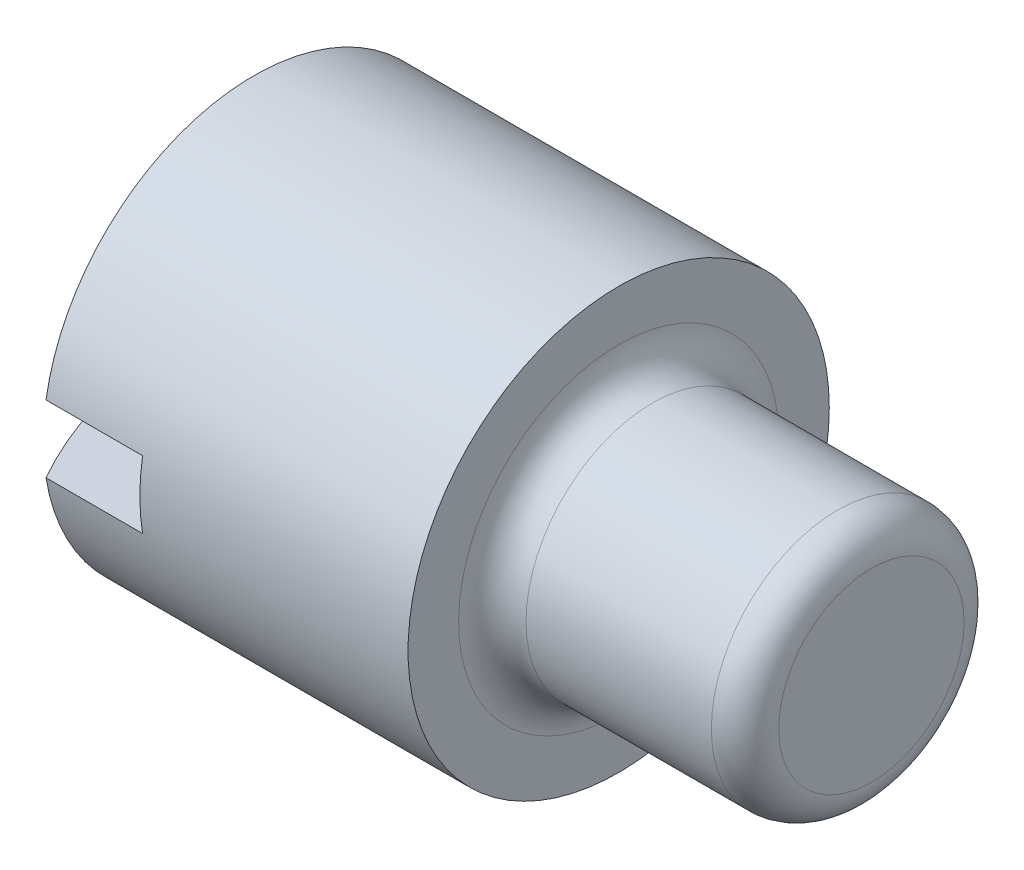
from build123d import *

# Parameters (mm, degrees)
REVOLVE_1_ANGLE     = 180
SKETCH_2_R          = 1.5
EXTRUDE_1_DEPTH     = 3
FILLET_1_R          = 0.4
SKETCH_3_OUTSIDE_W  = 15.25
SKETCH_3_OUTSIDE_H  = 15.25
SKETCH_3_OUTSIDE_R  = 2.5
CUT_EXTRUDE_1_DEPTH = 43
SKETCH_4_W          = 2.409556496
SKETCH_4_H          = 0.8
CUT_EXTRUDE_2_DEPTH = 21.5


with BuildPart() as part:
    # 草图1 → 旋转1 (revolve)
    with BuildSketch(Plane(origin=(0, 0, 0), x_dir=(0, 0, -1), z_dir=(1, 0, 0))):
        with BuildLine():
            Line((0, 5), (0, -5))
            ThreePointArc((0, -5), (-5, 0), (0, 5))
        make_face()
    revolve(axis=Axis((0, 5, 0), (0, -1, 0)), revolution_arc=REVOLVE_1_ANGLE)

    # 草图2 → 凸台-拉伸1 (add)
    with BuildSketch(Plane(origin=(0, 0, 0), x_dir=(0, 0, -1), z_dir=(1, 0, 0))):
        with Locations(Location((0, 0, 0), (0, 0, 180))):
            Circle(SKETCH_2_R)
    extrude(amount=EXTRUDE_1_DEPTH)

    # 圆角1
    fillet_1_edges = [part.edges().sort_by_distance(p)[0] for p in [
        (0, 0, -1.5),
        (3, 0, -1.5),
    ]]
    fillet(fillet_1_edges, radius=FILLET_1_R)

    # 草图3 outside → 切除-拉伸1 (cut)
    with BuildSketch(Plane(origin=(0, 0, 0), x_dir=(0, 0, -1), z_dir=(1, 0, 0))):
        Rectangle(SKETCH_3_OUTSIDE_W, SKETCH_3_OUTSIDE_H)
        Circle(SKETCH_3_OUTSIDE_R, mode=Mode.SUBTRACT)
    extrude(amount=-CUT_EXTRUDE_1_DEPTH, mode=Mode.SUBTRACT)

    # 草图4 → 切除-拉伸2 (cut, symmetric)
    with BuildSketch(Plane.XY):
        with Locations((-4.388752566, 0)):
            Rectangle(SKETCH_4_W, SKETCH_4_H)
    extrude(amount=CUT_EXTRUDE_2_DEPTH, both=True, mode=Mode.SUBTRACT)


solid = part.part
